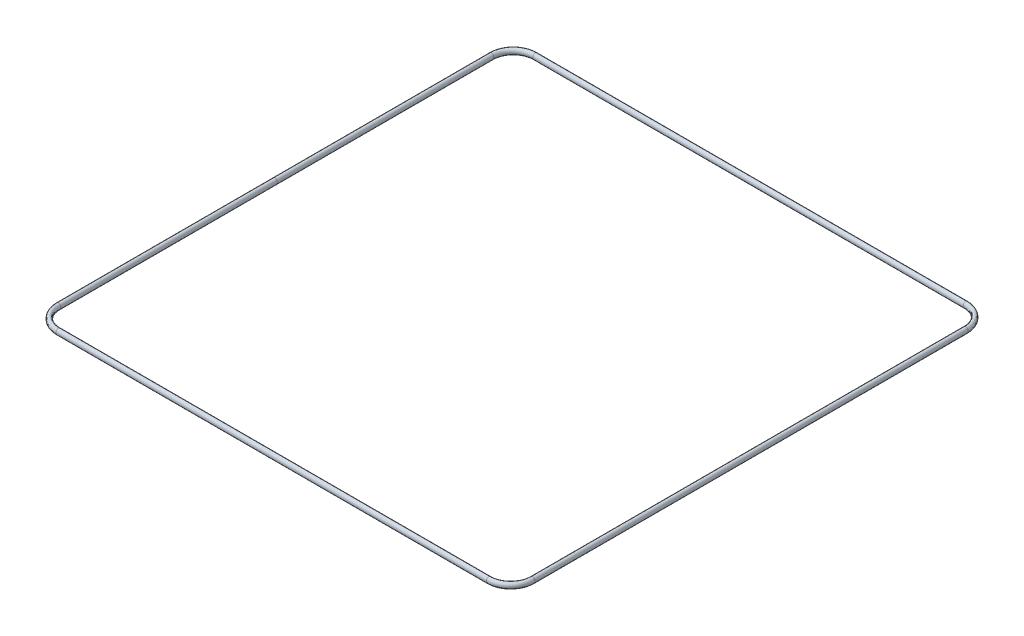
from build123d import *

# Parameters (mm, degrees)
SKETCH44_RX = 1.78
SKETCH44_RY = 1.397


with BuildPart() as part:
    # Sweep2: sweep along a path in Sketch1
    with BuildLine(Plane(origin=(0, 0, 0), x_dir=(1, 0, 0), z_dir=(0, 1, 0))) as sweep2_path:
        Line((-127.381, -141.097), (127.381, -141.097))
        ThreePointArc((127.381, -141.097), (136.540861243, -137.302861243), (140.335, -128.143))
        Line((140.335, -128.143), (140.335, 128.143))
        ThreePointArc((140.335, 128.143), (136.540861243, 137.302861243), (127.381, 141.097))
        Line((127.381, 141.097), (-127.381, 141.097))
        ThreePointArc((-127.381, 141.097), (-136.540861243, 137.302861243), (-140.335, 128.143))
        Line((-140.335, 128.143), (-140.335, -128.143))
        ThreePointArc((-140.335, -128.143), (-136.540861243, -137.302861243), (-127.381, -141.097))
    # Sketch44 → Sweep2 (sweep)
    with BuildSketch(Plane.XY):
        with Locations(Location((-140.335, 0), (0, 0, 90))):
            Ellipse(SKETCH44_RX, SKETCH44_RY)
    sweep(path=sweep2_path.line)


solid = part.part
